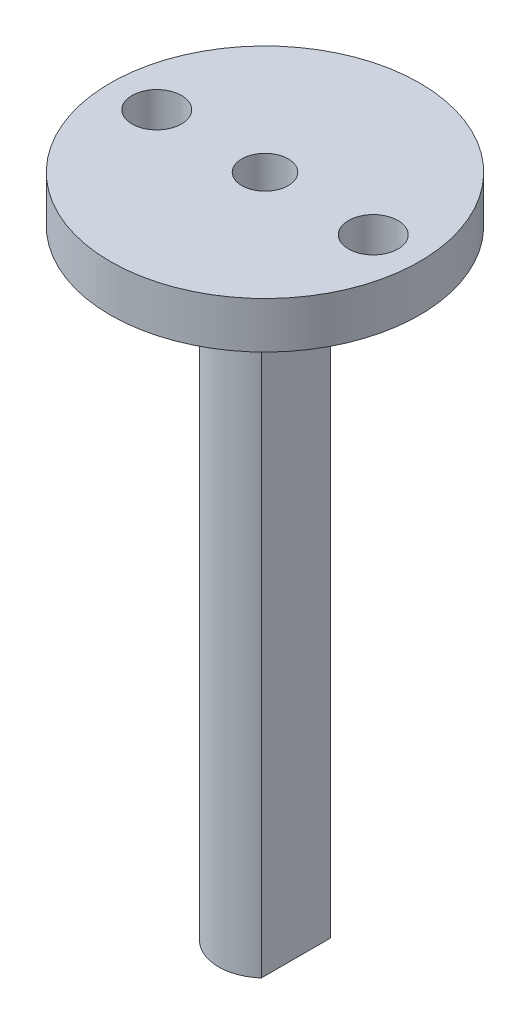
from build123d import *

# Parameters (mm, degrees)
SKETCH1_R           = 1.5
BOSS_EXTRUDE1_DEPTH = 40
SKETCH2_R           = 10
SKETCH2_R_2         = 1.6
SKETCH2_R_3         = 1.5
BOSS_EXTRUDE2_DEPTH = 3


with BuildPart() as part:
    # Sketch1 → Boss-Extrude1 (new body)
    with BuildSketch(Plane(origin=(0, 0, 0), x_dir=(1, 0, 0), z_dir=(0, 1, 0))):
        with BuildLine():
            Line((2, 2.236067977), (2, -2.236067977))
            ThreePointArc((2, -2.236067977), (-3, 0), (2, 2.236067977))
        make_face()
        with Locations(Location((0, 0, 0), (0, 0, 270))):
            Circle(SKETCH1_R, mode=Mode.SUBTRACT)
    extrude(amount=BOSS_EXTRUDE1_DEPTH)

    # Sketch2 → Boss-Extrude2 (add)
    with BuildSketch(Plane(origin=(0, 40, 0), x_dir=(1, 0, 0), z_dir=(0, 1, 0))):
        with Locations(Location((0, 0, 0), (0, 0, 270))):
            Circle(SKETCH2_R)
        with Locations(Location((-7, 0, 0), (0, 0, 270))):
            Circle(SKETCH2_R_2, mode=Mode.SUBTRACT)
        with Locations(Location((7, 0, 0), (0, 0, 270))):
            Circle(SKETCH2_R_2, mode=Mode.SUBTRACT)
        with Locations(Location((0, 0, 0), (0, 0, 270))):
            Circle(SKETCH2_R_3, mode=Mode.SUBTRACT)
    extrude(amount=BOSS_EXTRUDE2_DEPTH)


solid = part.part
